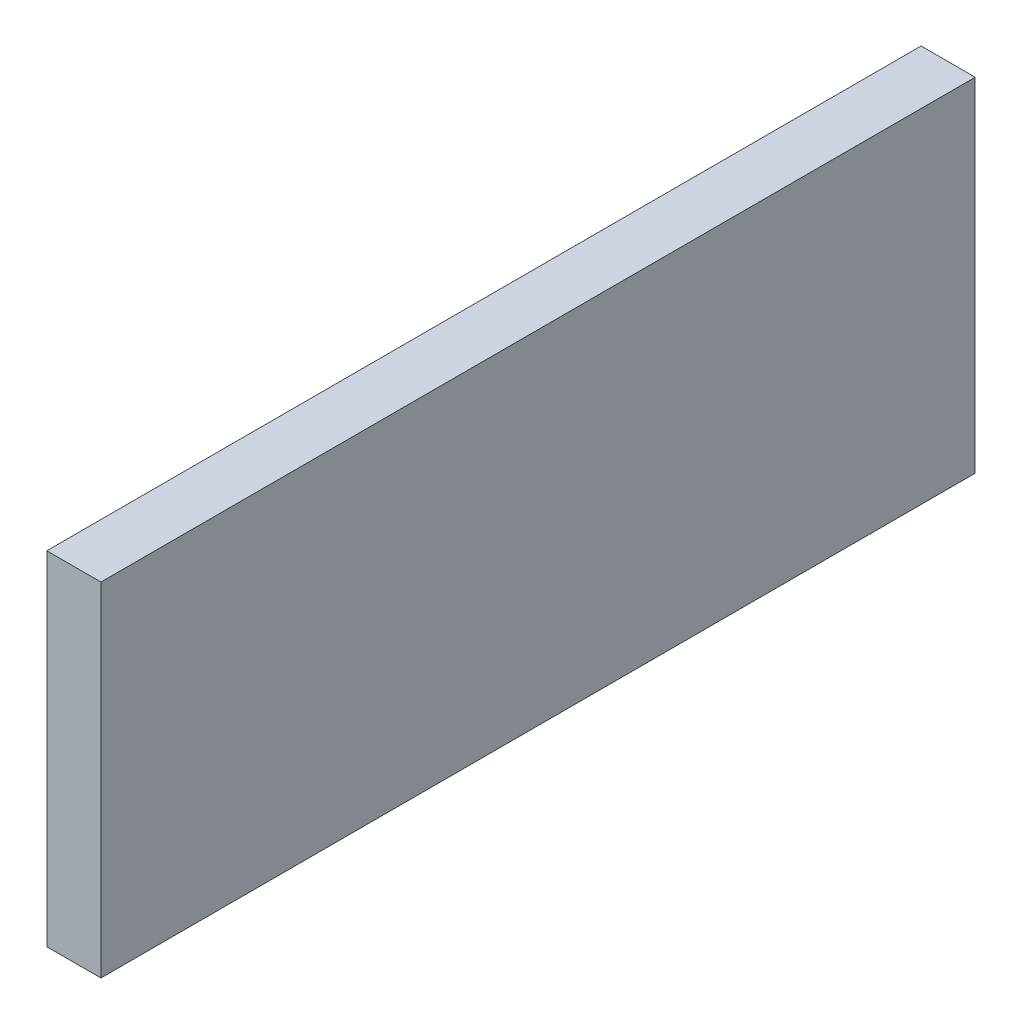
from build123d import *

# Parameters (mm, degrees)
SKETCH1_W           = 615.196448224
SKETCH1_H           = 241.3
BOSS_EXTRUDE1_DEPTH = 38.1


with BuildPart() as part:
    # Sketch1 → Boss-Extrude1 (new body)
    with BuildSketch(Plane.ZY.offset(1199.006701864)):
        with Locations((888.763930298, 149.413503955)):
            Rectangle(SKETCH1_W, SKETCH1_H)
    extrude(amount=-BOSS_EXTRUDE1_DEPTH)


solid = part.part
